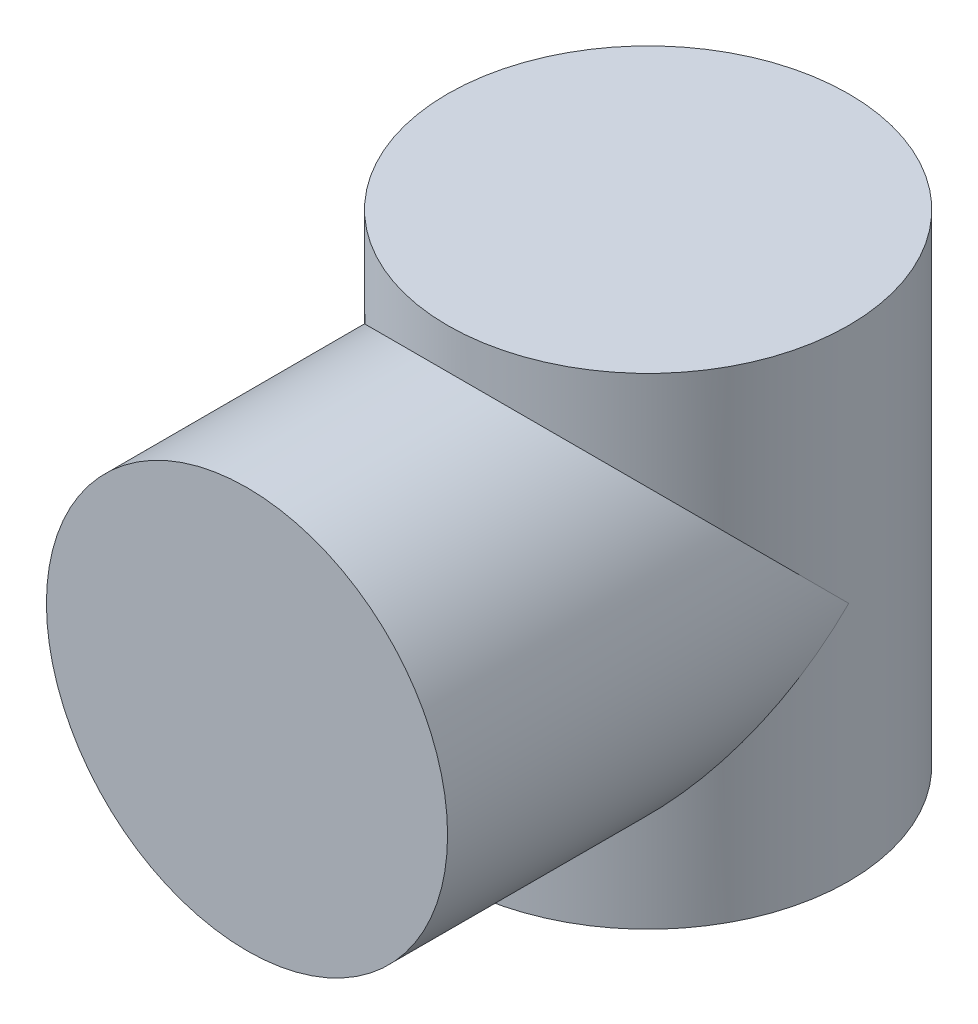
from build123d import *

# Parameters (mm, degrees)
SKETCH_1_R      = 50
EXTRUDE_1_DEPTH = 60
SKETCH_3_R      = 50
EXTRUDE_2_DEPTH = 100


with BuildPart() as part:
    # 草图1 → 凸台-拉伸1 (new, symmetric)
    with BuildSketch(Plane(origin=(0, 0, 0), x_dir=(1, 0, 0), z_dir=(0, 1, 0))):
        with Locations(Location((0, 0, 0), (0, 0, 270))):
            Circle(SKETCH_1_R)
    extrude(amount=EXTRUDE_1_DEPTH, both=True)

    # 草图3 → 凸台-拉伸2 (add)
    with BuildSketch(Plane.XY):
        Circle(SKETCH_3_R)
    extrude(amount=EXTRUDE_2_DEPTH)


solid = part.part
